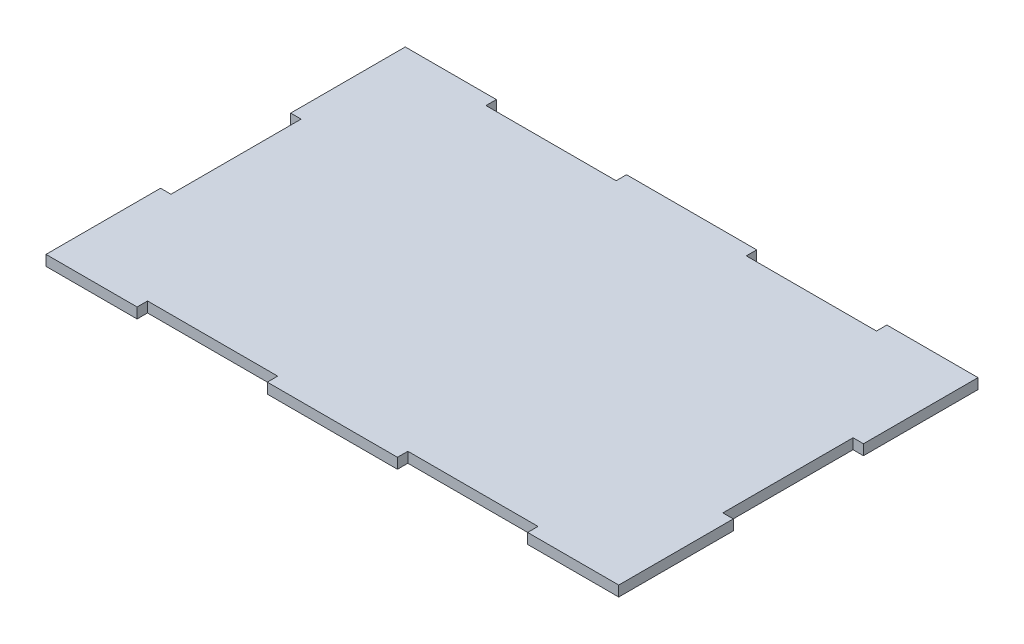
from build123d import *

# Parameters (mm, degrees)
BOSS_EXTRUDE1_DEPTH = 4


with BuildPart() as part:
    # Sketch2 → Boss-Extrude1 (new body)
    with BuildSketch(Plane(origin=(0, 0, 0), x_dir=(1, 0, 0), z_dir=(0, 1, 0))):
        Polygon((-110, 69), (-110, 25), (-106, 25), (-106, -25), (-110, -25), (-110, -69), (-75, -69), (-75, -65), (-25, -65), (-25, -69), (25, -69), (25, -65), (75, -65), (75, -69), (110, -69), (110, -25), (106, -25), (106, 25), (110, 25), (110, 69), (75, 69), (75, 65), (25, 65), (25, 69), (-25, 69), (-25, 65), (-75, 65), (-75, 69), align=None)
    extrude(amount=BOSS_EXTRUDE1_DEPTH)


solid = part.part
